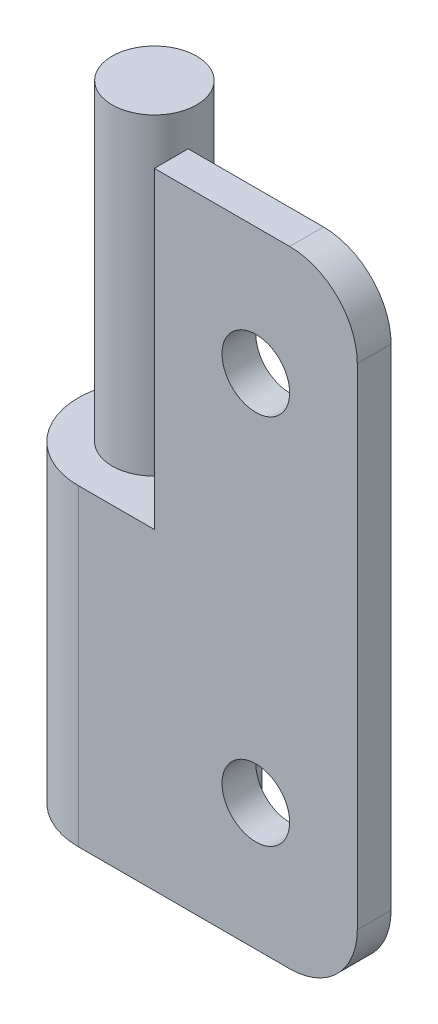
from build123d import *

# Parameters (mm, degrees)
SKETCH_1_R          = 2.5
EXTRUDE_1_DEPTH     = 18.5
SKETCH_2_W          = 12
SKETCH_2_H          = 2
EXTRUDE_2_DEPTH     = 18.5
CUT_EXTRUDE_1_REACH = 43.113
SKETCH_3_R          = 2
FILLET_1_R          = 4
SKETCH_4_R          = 2.5
EXTRUDE_3_DEPTH     = 37


with BuildPart() as part:
    # 草图1 → 凸台-拉伸1 (new body)
    with BuildSketch(Plane(origin=(0, 0, 0), x_dir=(1, 0, 0), z_dir=(0, 1, 0))):
        with BuildLine():
            Line((0, -4.5), (16.5, -4.5))
            Line((16.5, -4.5), (16.5, -2.5))
            Line((16.5, -2.5), (3.741657387, -2.5))
            ThreePointArc((3.741657387, -2.5), (-2.121320344, 3.968626967), (0, -4.5))
        make_face()
        with Locations(Location((0, 0, 0), (0, 0, 270))):
            Circle(SKETCH_1_R, mode=Mode.SUBTRACT)
    extrude(amount=EXTRUDE_1_DEPTH)

    # 草图2 → 凸台-拉伸2 (add)
    with BuildSketch(Plane(origin=(0, 18.5, 0), x_dir=(1, 0, 0), z_dir=(0, 1, 0))):
        with Locations((10.5, -3.5)):
            Rectangle(SKETCH_2_W, SKETCH_2_H)
    extrude(amount=EXTRUDE_2_DEPTH)

    # 草图3 → 切除-拉伸1 (cut, up to next)
    with BuildSketch(Plane(origin=(0, 0, 2.5), x_dir=(-1, 0, 0), z_dir=(0, 0, -1)), mode=Mode.PRIVATE) as cut_extrude_1_sk1:
        with Locations((-10.5, 7.5)):
            Circle(SKETCH_3_R)
    cut_extrude_1_tool1 = extrude(cut_extrude_1_sk1.sketch, amount=-CUT_EXTRUDE_1_REACH, mode=Mode.PRIVATE) & part.part
    # 草图3 → 切除-拉伸1 (cut, up to next)
    with BuildSketch(Plane(origin=(0, 0, 2.5), x_dir=(-1, 0, 0), z_dir=(0, 0, -1)), mode=Mode.PRIVATE) as cut_extrude_1_sk2:
        with Locations((-10.5, 29.5)):
            Circle(SKETCH_3_R)
    cut_extrude_1_tool2 = extrude(cut_extrude_1_sk2.sketch, amount=-CUT_EXTRUDE_1_REACH, mode=Mode.PRIVATE) & part.part
    add(cut_extrude_1_tool1.solids().sort_by_distance((10.5, 7.5, 2.5))[0], mode=Mode.SUBTRACT)
    add(cut_extrude_1_tool2.solids().sort_by_distance((10.5, 29.5, 2.5))[0], mode=Mode.SUBTRACT)

    # 圆角1
    fillet_1_edges = [part.edges().sort_by_distance(p)[0] for p in [
        (16.5, 37, 3.5),
        (16.5, 0, 3.5),
    ]]
    fillet(fillet_1_edges, radius=FILLET_1_R)

    # 草图4 → 凸台-拉伸3 (add)
    with BuildSketch(Plane.XZ):
        with Locations(Location((0, 0, 0), (0, 0, 270))):
            Circle(SKETCH_4_R)
    extrude(amount=-EXTRUDE_3_DEPTH)


solid = part.part
